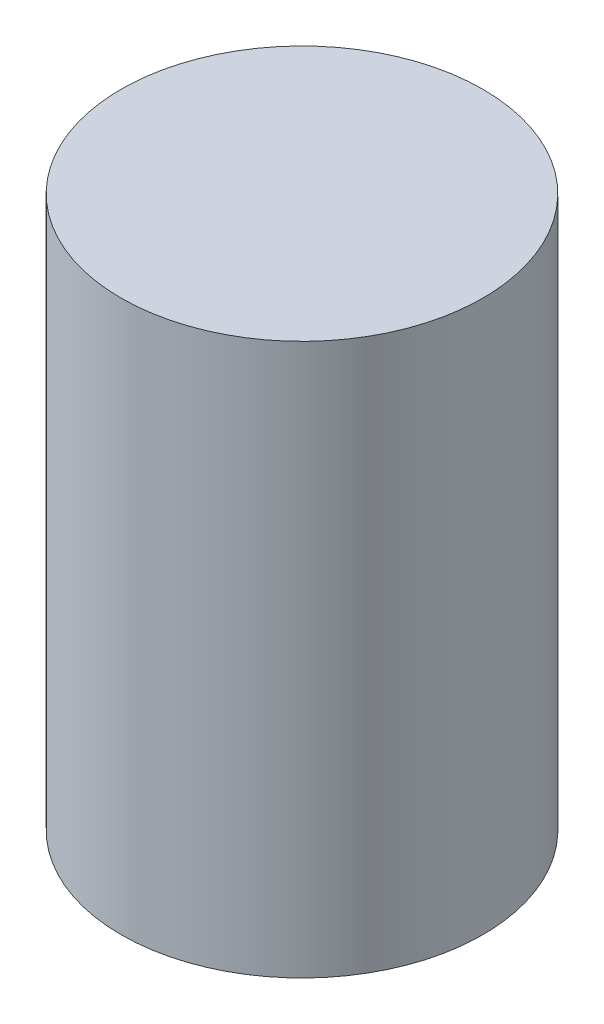
from build123d import *

# Parameters (mm, degrees)
SKETCH1_R           = 50
BOSS_EXTRUDE1_DEPTH = 152.4


with BuildPart() as part:
    # Sketch1 → Boss-Extrude1 (new body)
    with BuildSketch(Plane(origin=(0, 0, 0), x_dir=(1, 0, 0), z_dir=(0, 1, 0))):
        with Locations(Location((0, 0, 0), (0, 0, 90))):
            Circle(SKETCH1_R)
    extrude(amount=BOSS_EXTRUDE1_DEPTH)


solid = part.part
